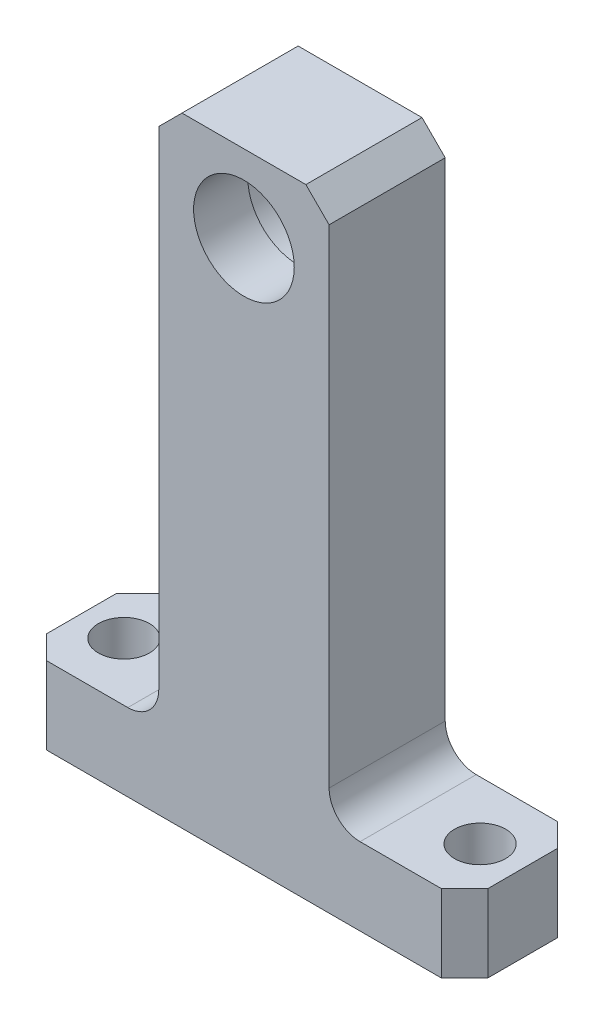
from build123d import *

# Parameters (mm, degrees)
BOSS_EXTRUDE1_DEPTH          = 7.5
FILLET1_R                    = 4
M6_CLEARANCE_HOLE1_D         = 6.6
F_4_0_4_DIAMETER_HOLE1_D     = 4
F_4_0_4_DIAMETER_HOLE1_DEPTH = 8
F_4_0_4_DIAMETER_HOLE1_TIP   = 1.201721238
CUT_EXTRUDE1_DEPTH           = 8
CHAMFER1_SIZE                = 3
CUT_EXTRUDE6_DEPTH           = 0.5
CUT_EXTRUDE6_DEPTH_BACK      = 86.255498356
SKETCH12_R                   = 7.525
CUT_EXTRUDE7_DEPTH           = 86.255498356
CUT_EXTRUDE7_DEPTH_BACK      = 86.255498356
SKETCH13_R                   = 6.5
CHAMFER3_SIZE                = 3


with BuildPart() as part:
    # Sketch1 → Boss-Extrude1 (new, symmetric)
    with BuildSketch(Plane.XY):
        Polygon((-11, 0), (11, 0), (11, -70), (28.5, -70), (28.5, -80), (-28.5, -80), (-28.5, -70), (-11, -70), align=None)
    extrude(amount=BOSS_EXTRUDE1_DEPTH, both=True)

    # Fillet1
    fillet1_edges = [part.edges().sort_by_distance(p)[0] for p in [
        (11, -70, 0),
        (-11, -70, 0),
    ]]
    fillet(fillet1_edges, radius=FILLET1_R)

    # M6 Clearance Hole1 (through all)
    with Locations(Plane(origin=(0, -80, 0), x_dir=(-1, 0, 0), z_dir=(0, -1, 0))):
        with Locations((23, 0), (-23, 0)):
            Hole(M6_CLEARANCE_HOLE1_D / 2)

    # Ø4.0 (4) Diameter Hole1
    with Locations(Plane(origin=(0, -80, 0), x_dir=(-1, 0, 0), z_dir=(0, -1, 0))):
        with Locations((12.5, 0)):
            Hole(F_4_0_4_DIAMETER_HOLE1_D / 2, depth=F_4_0_4_DIAMETER_HOLE1_DEPTH)
            with Locations((0, 0, -(F_4_0_4_DIAMETER_HOLE1_DEPTH + F_4_0_4_DIAMETER_HOLE1_TIP / 2))):  # 118° drill point
                Cone(0, F_4_0_4_DIAMETER_HOLE1_D / 2, F_4_0_4_DIAMETER_HOLE1_TIP, mode=Mode.SUBTRACT)

    # Sketch5 → Cut-Extrude1 (cut)
    with BuildSketch(Plane.XZ.offset(80)):
        with BuildLine():
            Line((10, 2), (15, 2))
            ThreePointArc((15, 2), (17, 0), (15, -2))
            Line((15, -2), (10, -2))
            ThreePointArc((10, -2), (8, 0), (10, 2))
        make_face()
    extrude(amount=-CUT_EXTRUDE1_DEPTH, mode=Mode.SUBTRACT)

    # Chamfer1
    chamfer1_edges = [part.edges().sort_by_distance(p)[0] for p in [
        (-28.5, -75, 7.5),
        (28.5, -75, 7.5),
        (28.5, -75, -7.5),
        (-28.5, -75, -7.5),
    ]]
    chamfer(chamfer1_edges, length=CHAMFER1_SIZE)

    # Sketch12 → Cut-Extrude6 (cut, two sides: drawn at the far end of the back side and taken through both)
    with BuildSketch(Plane.XY.offset(-CUT_EXTRUDE6_DEPTH_BACK)):
        with Locations(Location((0, -10, 0), (0, 0, 180))):
            Circle(SKETCH12_R)
    extrude(amount=CUT_EXTRUDE6_DEPTH + CUT_EXTRUDE6_DEPTH_BACK, mode=Mode.SUBTRACT)

    # Sketch13 → Cut-Extrude7 (cut, two sides: drawn at the far end of the back side and taken through both)
    with BuildSketch(Plane.XY.offset(-CUT_EXTRUDE7_DEPTH_BACK)):
        with Locations((0, -10)):
            Circle(SKETCH13_R)
    extrude(amount=CUT_EXTRUDE7_DEPTH + CUT_EXTRUDE7_DEPTH_BACK, mode=Mode.SUBTRACT)

    # Chamfer3
    chamfer3_edges = [part.edges().sort_by_distance(p)[0] for p in [
        (-11, 0, 0),
        (11, 0, 0),
    ]]
    chamfer(chamfer3_edges, length=CHAMFER3_SIZE)


solid = part.part
